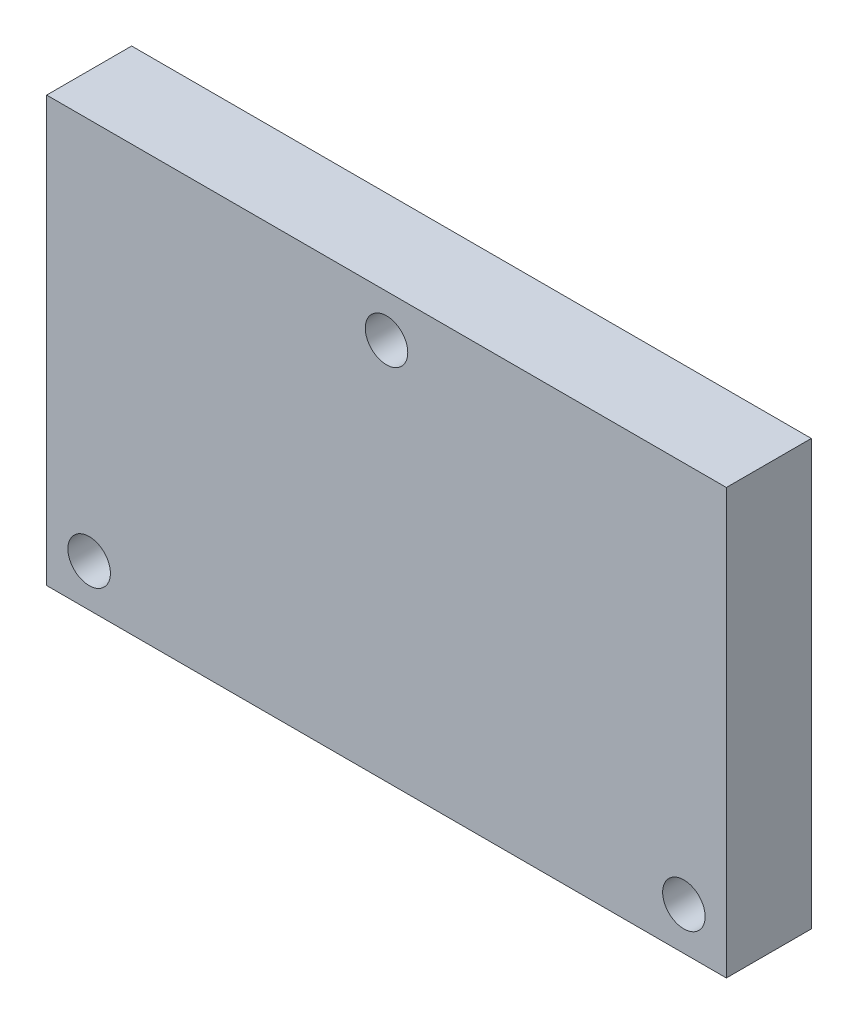
from build123d import *

# Parameters (mm, degrees)
SKETCH_1_W      = 48
SKETCH_1_H      = 30
SKETCH_1_R      = 1.5
EXTRUDE_1_DEPTH = 6


with BuildPart() as part:
    # Эскиз1 → Бобышка-Вытянуть1 (new body)
    with BuildSketch(Plane.XY):
        with Locations((-44.25, -351)):
            Rectangle(SKETCH_1_W, SKETCH_1_H)
        with Locations((-65.25, -363)):
            Circle(SKETCH_1_R, mode=Mode.SUBTRACT)
        with Locations((-23.25, -363)):
            Circle(SKETCH_1_R, mode=Mode.SUBTRACT)
        with Locations((-44.25, -339)):
            Circle(SKETCH_1_R, mode=Mode.SUBTRACT)
    extrude(amount=EXTRUDE_1_DEPTH)


solid = part.part
